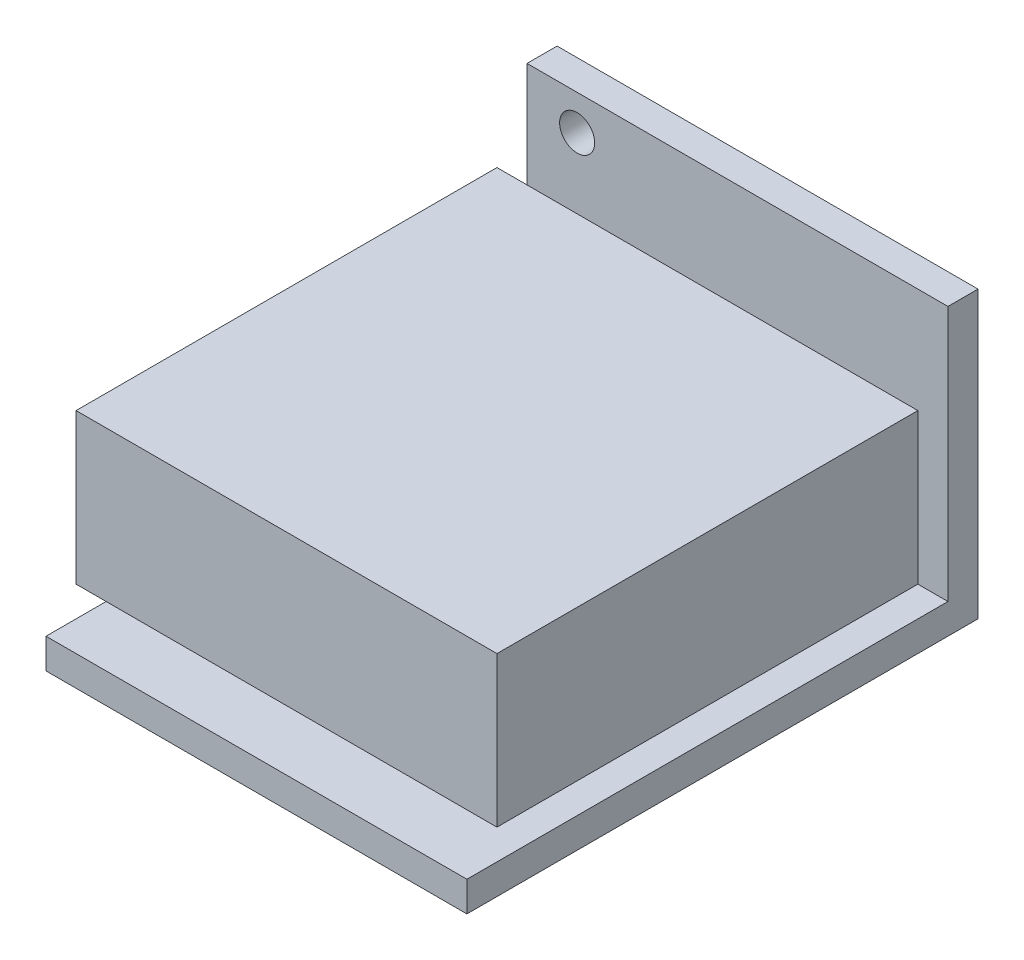
from build123d import *

# Parameters (mm, degrees)
CROQUIS1_W              = 42
CROQUIS1_H              = 42
SALIENTE_EXTRUIR1_DEPTH = 15
SALIENTE_EXTRUIR2_DEPTH = 42
CROQUIS3_R              = 1.75
CORTAR_EXTRUIR1_DEPTH   = 58.019733426


with BuildPart() as part:
    # Croquis1 → Saliente-Extruir1 (new body)
    with BuildSketch(Plane(origin=(0, 0, 0), x_dir=(1, 0, 0), z_dir=(0, 1, 0))):
        Rectangle(CROQUIS1_W, CROQUIS1_H)
    extrude(amount=SALIENTE_EXTRUIR1_DEPTH)


with BuildPart() as body_2:
    # Croquis2 → Saliente-Extruir2 (new body)
    with BuildSketch(Plane(origin=(21, 0, 0), x_dir=(0, 0, -1), z_dir=(1, 0, 0))):
        Polygon((-24, -3), (-24, -6), (27, -6), (27, 22.5), (24, 22.5), (24, -3), align=None)
    extrude(amount=-SALIENTE_EXTRUIR2_DEPTH)

    # Croquis3 → Cortar-Extruir1 (cut, through all)
    with BuildSketch(Plane.XY.offset(-24)):
        with Locations((-16, 19)):
            Circle(CROQUIS3_R)
    extrude(amount=-CORTAR_EXTRUIR1_DEPTH, mode=Mode.SUBTRACT)


solid = Compound([part.part, body_2.part])
